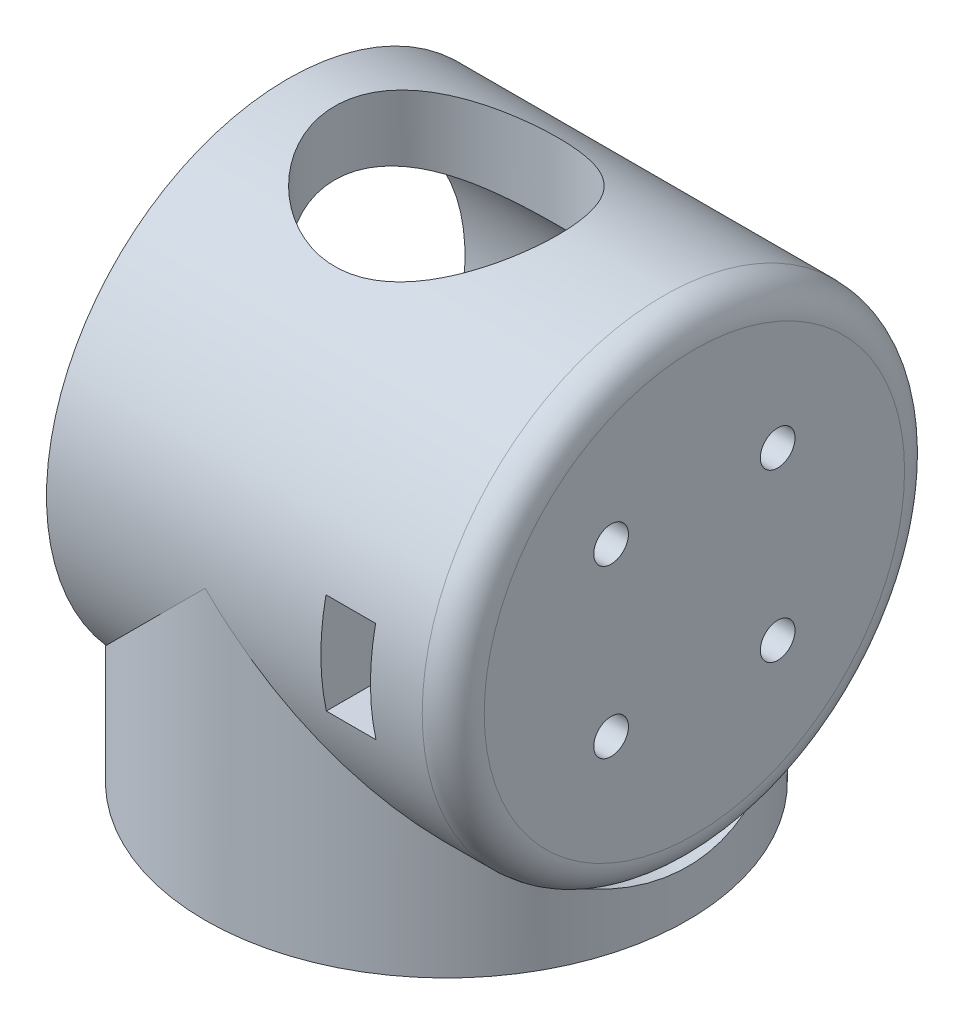
from build123d import *
from build123d.topology import SkipClean

# Parameters (mm, degrees)
SKETCH_1_R                      = 38.9
SKETCH_1_R_2                    = 28.4
EXTRUDE_1_DEPTH                 = 46.39
EXTRUDE_2_DEPTH                 = 40
EXTRUDE_2_DEPTH_BACK            = 40
SKETCH_2_R                      = 38.9
SKETCH_2_R_2                    = 28.4
CUT_EXTRUDE_1_DEPTH             = 102.919547232
CUT_EXTRUDE_1_DEPTH_BACK        = 102.919547232
SKETCH_3_R                      = 28.4
CUT_EXTRUDE_2_REACH             = 103.92
SKETCH_4_R                      = 28.4
CUT_EXTRUDE_2_DIRECTION_2_DEPTH = 102.919547232
SKETCH_5_R                      = 28.4
EXTRUDE_3_DEPTH                 = 10
HOLE_WIZARD_M3_1_D              = 3.2
HOLE_WIZARD_M3_1_DEPTH          = 10
HOLE_WIZARD_M3_1_CBORE_D        = 5.6
HOLE_WIZARD_M3_1_CBORE_DEPTH    = 4.5
EXTRUDE_START                   = 40
SKETCH_8_R                      = 28.4
EXTRUDE_4_DEPTH                 = 13.35
CUT_EXTRUDE_3_REACH             = 163.92
CUT_EXTRUDE_3_END_RADIUS        = 38.9
CUT_EXTRUDE_START               = 60
SKETCH_9_R                      = 18
CUT_EXTRUDE_4_DEPTH             = 102.919547354
CUT_EXTRUDE_4_DEPTH_BACK        = 102.919547354
HOLE_WIZARD_M3_2_D              = 3.2
HOLE_WIZARD_M3_2_CBORE_D        = 5.6
HOLE_WIZARD_M3_2_CBORE_DEPTH    = 6.35
CUT_EXTRUDE_5_DEPTH             = 124.237957322
CUT_EXTRUDE_5_DEPTH_BACK        = 14.4
SKETCH_14_R                     = 38.9
CUT_EXTRUDE_START_2             = -25.6
SKETCH_15_R                     = 28.6
CUT_EXTRUDE_6_DEPTH             = 52.25


with BuildPart() as part:
    # 草图1 → 凸台-拉伸1 (new body)
    with BuildSketch(Plane(origin=(0, 0, 0), x_dir=(1, 0, 0), z_dir=(0, 1, 0))):
        with Locations(Location((0, 0, 0), (0, 0, 270))):
            Circle(SKETCH_1_R)
        with Locations(Location((0, 0, 0), (0, 0, 270))):
            Circle(SKETCH_1_R_2, mode=Mode.SUBTRACT)
    extrude(amount=EXTRUDE_1_DEPTH)

    # 草图2 → 凸台-拉伸2 (add, two sides: drawn at the far end of the back side and taken through both)
    with BuildSketch(Plane(origin=(0, 0, 0), x_dir=(0, 0, -1), z_dir=(1, 0, 0)).offset(-EXTRUDE_2_DEPTH_BACK)):
        with Locations((0, 46.39)):
            Circle(SKETCH_2_R)
        with Locations((0, 46.39)):
            Circle(SKETCH_2_R_2, mode=Mode.SUBTRACT)
    extrude(amount=EXTRUDE_2_DEPTH + EXTRUDE_2_DEPTH_BACK)

    # 草图3 → 切除-拉伸1 (cut, two sides: drawn at the far end of the back side and taken through both)
    with BuildSketch(Plane(origin=(0, 0, 0), x_dir=(0, 0, -1), z_dir=(1, 0, 0)).offset(-CUT_EXTRUDE_1_DEPTH_BACK)):
        with Locations((0, 46.39)):
            Circle(SKETCH_3_R)
    extrude(amount=CUT_EXTRUDE_1_DEPTH + CUT_EXTRUDE_1_DEPTH_BACK, mode=Mode.SUBTRACT)

    # 草图4 → 切除-拉伸2 (cut, up to next)
    with BuildSketch(Plane(origin=(0, 0, 0), x_dir=(1, 0, 0), z_dir=(0, 1, 0)), mode=Mode.PRIVATE) as cut_extrude_2_sk1:
        with Locations(Location((0, 0, 0), (0, 0, 270))):
            Circle(SKETCH_4_R)
    cut_extrude_2_tool1 = extrude(cut_extrude_2_sk1.sketch, amount=CUT_EXTRUDE_2_REACH, mode=Mode.PRIVATE) & part.part
    add(cut_extrude_2_tool1.solids().sort_by_distance((0, 0, 0))[0], mode=Mode.SUBTRACT)

    # 草图4 → 切除-拉伸2 direction 2 (cut)
    with SkipClean():  # the faces are left unmerged after this step: merging them gives an invalid solid
        with BuildSketch(Plane(origin=(0, 0, 0), x_dir=(1, 0, 0), z_dir=(0, 1, 0))):
            with Locations(Location((0, 0, 0), (0, 0, 270))):
                Circle(SKETCH_4_R)
        extrude(amount=-CUT_EXTRUDE_2_DIRECTION_2_DEPTH, mode=Mode.SUBTRACT)

    # 草图5 → 凸台-拉伸3 (add)
    with BuildSketch(Plane(origin=(0, 0, 0), x_dir=(1, 0, 0), z_dir=(0, 1, 0))):
        with Locations(Location((0, 0, 0), (0, 0, 270))):
            Circle(SKETCH_5_R)
    extrude(amount=EXTRUDE_3_DEPTH)

    # M3 六角头螺栓的柱形沉头孔1
    with Locations(Plane(origin=(0, 10, 0), x_dir=(1, 0, 0), z_dir=(0, 1, 0))):
        with Locations((-6.75, 11.691342951), (-59.652661243, 23.30322664), (6.75, 11.691342951), (13.5, 0), (6.75, -11.691342951), (-6.75, -11.691342951), (-13.5, 0)):
            CounterBoreHole(HOLE_WIZARD_M3_1_D / 2, HOLE_WIZARD_M3_1_CBORE_D / 2, HOLE_WIZARD_M3_1_CBORE_DEPTH, depth=HOLE_WIZARD_M3_1_DEPTH)

    # 草图8 → 凸台-拉伸4 (add)
    with BuildSketch(Plane(origin=(0, 0, 0), x_dir=(0, 0, -1), z_dir=(1, 0, 0)).offset(EXTRUDE_START)):
        with Locations((0, 46.39)):
            Circle(SKETCH_8_R)
    extrude(amount=-EXTRUDE_4_DEPTH)

    # 切除-拉伸3: up to this cylinder (the profile starts inside it)
    with SkipClean():  # the faces are left unmerged after this step: merging them gives an invalid solid
        cut_extrude_3_end = Plane(origin=(0, 46.39, 0), z_dir=(1, 0, 0)) * Cylinder(CUT_EXTRUDE_3_END_RADIUS, 406.64, mode=Mode.PRIVATE)
        # 草图9 → 切除-拉伸3 (cut, up to the surface)
        with BuildSketch(Plane(origin=(0, 0, 0), x_dir=(1, 0, 0), z_dir=(0, 1, 0)).offset(CUT_EXTRUDE_START), mode=Mode.PRIVATE) as cut_extrude_3_sk1:
            with Locations(Location((0, 0, 0), (0, 0, 90))):
                Circle(SKETCH_9_R)
        cut_extrude_3_tool1 = extrude(cut_extrude_3_sk1.sketch, amount=CUT_EXTRUDE_3_REACH, mode=Mode.PRIVATE) & cut_extrude_3_end
        add(cut_extrude_3_tool1.solids().sort_by_distance((0, 60, 0))[0], mode=Mode.SUBTRACT)

    # 草图10 → 切除-拉伸4 (cut, two sides: drawn at the far end of the back side and taken through both)
    with SkipClean():  # the faces are left unmerged after this step: merging them gives an invalid solid
        with BuildSketch(Plane.XY.offset(-CUT_EXTRUDE_4_DEPTH_BACK)):
            Polygon((26.65, 46.39), (26.65, 38.115083969), (18.65, 38.115083969), (18.65, 46.39), (18.65, 54.39), (26.65, 54.39), align=None)
        extrude(amount=CUT_EXTRUDE_4_DEPTH + CUT_EXTRUDE_4_DEPTH_BACK, mode=Mode.SUBTRACT)

    # M3 六角头螺栓的柱形沉头孔2 (through all)
    with Locations(Plane(origin=(40, 0, 0), x_dir=(0, 0, -1), z_dir=(1, 0, 0))):
        with Locations((-13.435028843, 59.825028843), (13.435028843, 59.825028843), (13.435028843, 32.954971157), (-13.435028843, 32.954971157)):
            CounterBoreHole(HOLE_WIZARD_M3_2_D / 2, HOLE_WIZARD_M3_2_CBORE_D / 2, HOLE_WIZARD_M3_2_CBORE_DEPTH)

    # 草图13 → 切除-旋转1 (revolve, cut)
    with SkipClean():  # the faces are left unmerged after this step: merging them gives an invalid solid
        with BuildSketch(Plane.XY, mode=Mode.PRIVATE) as cut_revolve_1_sk:
            with BuildLine():
                Line((35, 85.29), (40, 85.29))
                Line((40, 85.29), (40, 80.29))
                ThreePointArc((40, 80.29), (38.535533906, 83.825533906), (35, 85.29))
            make_face()
        revolve(cut_revolve_1_sk.sketch.rotate(Axis((-40, 46.39, 0), (1, 0, 0)), 270), axis=Axis((-40, 46.39, 0), (1, 0, 0)), mode=Mode.SUBTRACT)

    # 草图14 → 切除-拉伸5 (cut, two sides: drawn at the far end of the back side and taken through both)
    with SkipClean():  # the faces are left unmerged after this step: merging them gives an invalid solid
        with BuildSketch(Plane.ZY.offset(40).offset(-CUT_EXTRUDE_5_DEPTH_BACK)):
            with Locations((0, 46.39)):
                Circle(SKETCH_14_R)
        extrude(amount=CUT_EXTRUDE_5_DEPTH + CUT_EXTRUDE_5_DEPTH_BACK, mode=Mode.SUBTRACT)

    # 草图15 → 切除-拉伸6 (cut)
    with SkipClean():  # the faces are left unmerged after this step: merging them gives an invalid solid
        with BuildSketch(Plane(origin=(0, 0, 0), x_dir=(0, 0, -1), z_dir=(1, 0, 0)).offset(CUT_EXTRUDE_START_2)):
            with Locations((0, 46.39)):
                Circle(SKETCH_15_R)
        extrude(amount=CUT_EXTRUDE_6_DEPTH, mode=Mode.SUBTRACT)


solid = part.part
